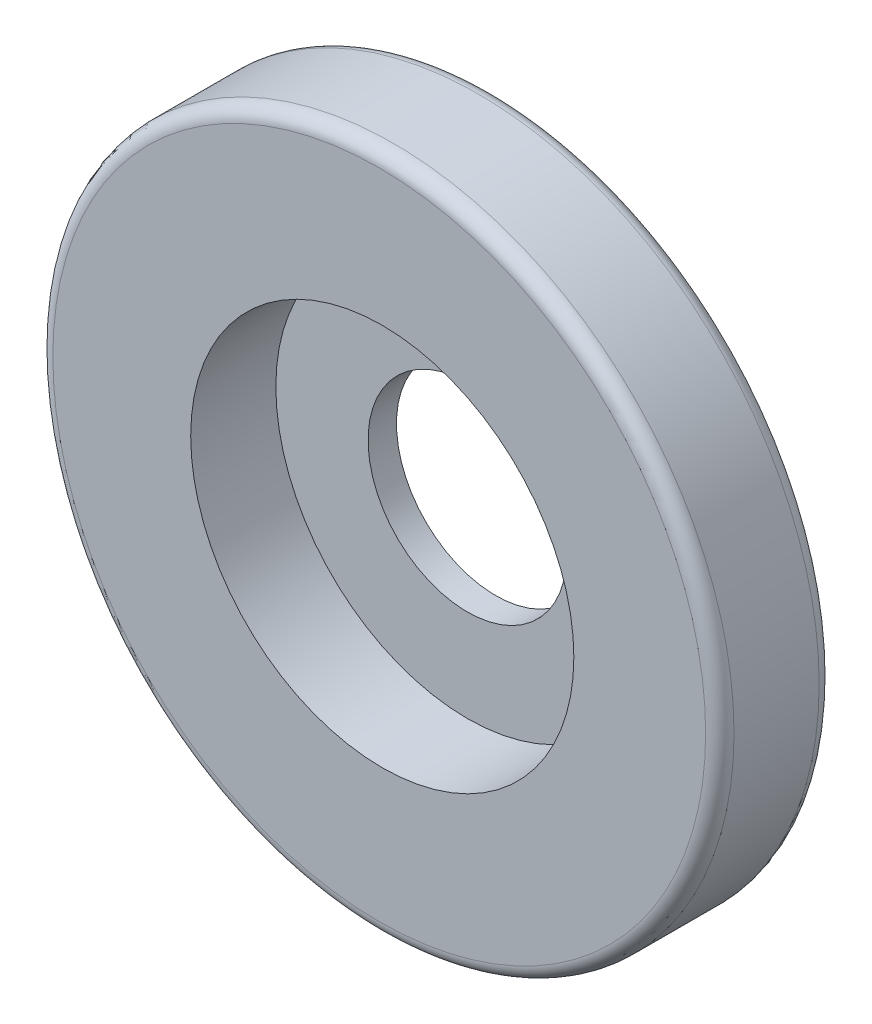
from build123d import *

# Parameters (mm, degrees)
SKETCH1_R           = 6
SKETCH1_R_2         = 1.75
BOSS_EXTRUDE1_DEPTH = 0.5
SKETCH2_R           = 6
SKETCH2_R_2         = 3.375
BOSS_EXTRUDE2_DEPTH = 1.5
FILLET1_R           = 0.25


with BuildPart() as part:
    # Sketch1 → Boss-Extrude1 (new body)
    with BuildSketch(Plane.XY):
        with Locations((-0.053524078, 0)):
            Circle(SKETCH1_R)
        Circle(SKETCH1_R_2, mode=Mode.SUBTRACT)
    extrude(amount=BOSS_EXTRUDE1_DEPTH)

    # Sketch2 → Boss-Extrude2 (add)
    with BuildSketch(Plane.XY.offset(0.5)):
        with Locations((-0.053524078, 0)):
            Circle(SKETCH2_R)
        Circle(SKETCH2_R_2, mode=Mode.SUBTRACT)
    extrude(amount=BOSS_EXTRUDE2_DEPTH)

    # Fillet1
    fillet1_edges = [part.edges().sort_by_distance(p)[0] for p in [
        (-6.053524078, 0, 2),
        (-6.053524078, 0, 0),
    ]]
    fillet(fillet1_edges, radius=FILLET1_R)


solid = part.part
